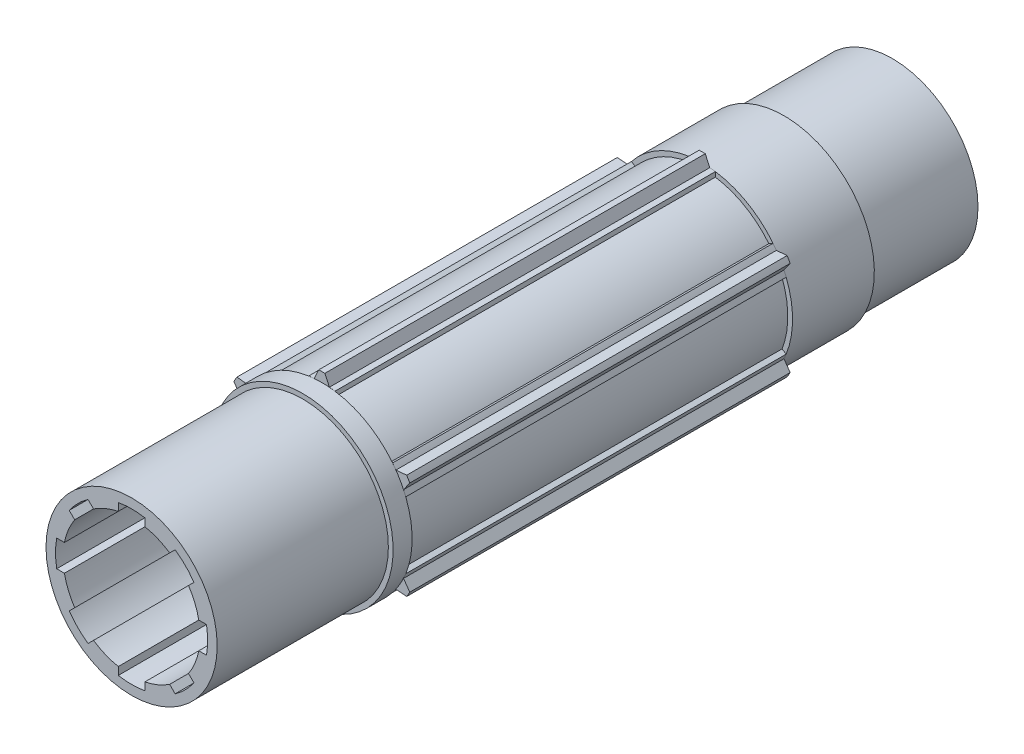
from build123d import *

# Parameters (mm, degrees)
SKETCH1_R           = 22.5
BOSS_EXTRUDE1_DEPTH = 200
BOSS_EXTRUDE2_START = 50
BOSS_EXTRUDE2_DEPTH = 100
BOSS_EXTRUDE3_START = -50
SKETCH4_R           = 23.75
SKETCH4_R_2         = 22.25
BOSS_EXTRUDE3_DEPTH = 5
BOSS_EXTRUDE4_START = -171.5
SKETCH4_2_R         = 23.75
SKETCH4_2_R_2       = 22.25
BOSS_EXTRUDE4_DEPTH = 21.5


with BuildPart() as part:
    # Sketch1 → Boss-Extrude1 (new body)
    with BuildSketch(Plane.XY):
        Circle(SKETCH1_R)
        with BuildLine():
            Line((-3.5, 19.691368668), (-3.5, 17.656443583))
            ThreePointArc((-3.5, 17.656443583), (-6.888301783, 16.629831585), (-10.010117255, 14.959864723))
            Line((-10.010117255, 14.959864723), (-11.449026581, 16.39877405))
            ThreePointArc((-11.449026581, 16.39877405), (-14.142135624, 14.142135624), (-16.39877405, 11.449026581))
            Line((-16.39877405, 11.449026581), (-14.959864723, 10.010117255))
            ThreePointArc((-14.959864723, 10.010117255), (-16.629831585, 6.888301783), (-17.656443583, 3.5))
            Line((-17.656443583, 3.5), (-19.691368668, 3.5))
            ThreePointArc((-19.691368668, 3.5), (-20, 0), (-19.691368668, -3.5))
            Line((-19.691368668, -3.5), (-17.656443583, -3.5))
            ThreePointArc((-17.656443583, -3.5), (-16.629831585, -6.888301783), (-14.959864723, -10.010117255))
            Line((-14.959864723, -10.010117255), (-16.39877405, -11.449026581))
            ThreePointArc((-16.39877405, -11.449026581), (-14.142135624, -14.142135624), (-11.449026581, -16.39877405))
            Line((-11.449026581, -16.39877405), (-10.010117255, -14.959864723))
            ThreePointArc((-10.010117255, -14.959864723), (-6.888301783, -16.629831585), (-3.5, -17.656443583))
            Line((-3.5, -17.656443583), (-3.5, -19.691368668))
            ThreePointArc((-3.5, -19.691368668), (0, -20), (3.5, -19.691368668))
            Line((3.5, -19.691368668), (3.5, -17.656443583))
            ThreePointArc((3.5, -17.656443583), (6.888301783, -16.629831585), (10.010117255, -14.959864723))
            Line((10.010117255, -14.959864723), (11.449026581, -16.39877405))
            ThreePointArc((11.449026581, -16.39877405), (14.142135624, -14.142135624), (16.39877405, -11.449026581))
            Line((16.39877405, -11.449026581), (14.959864723, -10.010117255))
            ThreePointArc((14.959864723, -10.010117255), (16.629831585, -6.888301783), (17.656443583, -3.5))
            Line((17.656443583, -3.5), (19.691368668, -3.5))
            ThreePointArc((19.691368668, -3.5), (20, 0), (19.691368668, 3.5))
            Line((19.691368668, 3.5), (17.656443583, 3.5))
            ThreePointArc((17.656443583, 3.5), (16.629831585, 6.888301783), (14.959864723, 10.010117255))
            Line((14.959864723, 10.010117255), (16.39877405, 11.449026581))
            ThreePointArc((16.39877405, 11.449026581), (14.142135624, 14.142135624), (11.449026581, 16.39877405))
            Line((11.449026581, 16.39877405), (10.010117255, 14.959864723))
            ThreePointArc((10.010117255, 14.959864723), (6.888301783, 16.629831585), (3.5, 17.656443583))
            Line((3.5, 17.656443583), (3.5, 19.691368668))
            ThreePointArc((3.5, 19.691368668), (0, 20), (-3.5, 19.691368668))
        make_face(mode=Mode.SUBTRACT)
    extrude(amount=BOSS_EXTRUDE1_DEPTH)

    # Sketch3 → Boss-Extrude2 (add)
    with BuildSketch(Plane.XY.offset(BOSS_EXTRUDE2_START)):
        with BuildLine():
            Line((-2.000027302, 23.665962711), (-0.80077241, 26.237773126))
            ThreePointArc((-0.80077241, 26.237773126), (0, 26.249990002), (0.80077241, 26.237773126))
            Line((0.80077241, 26.237773126), (2.000027302, 23.665962711))
            ThreePointArc((2.000027302, 23.665962711), (2.731879206, 23.592683956), (3.461111111, 23.496778718))
            Line((3.461111111, 23.496778718), (3.461111111, 21.979153985))
            ThreePointArc((3.461111111, 21.979153985), (0, 22.25), (-3.461111111, 21.979153985))
            Line((-3.461111111, 21.979153985), (-3.461111111, 23.496778718))
            ThreePointArc((-3.461111111, 23.496778718), (-2.731879206, 23.592683956), (-2.000027302, 23.665962711))
        make_face()
        with BuildLine():
            Line((17.303950149, 13.98698714), (18.618251721, 14.745799506))
            ThreePointArc((18.618251721, 14.745799506), (19.065924046, 14.162218771), (19.495311261, 13.565055807))
            Line((19.495311261, 13.565055807), (22.322191861, 13.812375813))
            ThreePointArc((22.322191861, 13.812375813), (22.73315819, 13.124995001), (23.122964271, 12.425397313))
            Line((23.122964271, 12.425397313), (21.495338563, 10.100906903))
            ThreePointArc((21.495338563, 10.100906903), (21.797803252, 9.430465185), (22.079362832, 8.750979211))
            Line((22.079362832, 8.750979211), (20.76506126, 7.992166845))
            ThreePointArc((20.76506126, 7.992166845), (19.269065234, 11.125), (17.303950149, 13.98698714))
        make_face()
        with BuildLine():
            Line((20.76506126, -7.992166845), (22.079362832, -8.750979211))
            ThreePointArc((22.079362832, -8.750979211), (21.797803252, -9.430465185), (21.495338563, -10.100906903))
            Line((21.495338563, -10.100906903), (23.122964271, -12.425397313))
            ThreePointArc((23.122964271, -12.425397313), (22.73315819, -13.124995001), (22.322191861, -13.812375813))
            Line((22.322191861, -13.812375813), (19.495311261, -13.565055807))
            ThreePointArc((19.495311261, -13.565055807), (19.065924046, -14.162218771), (18.618251721, -14.745799506))
            Line((18.618251721, -14.745799506), (17.303950149, -13.98698714))
            ThreePointArc((17.303950149, -13.98698714), (19.269065234, -11.125), (20.76506126, -7.992166845))
        make_face()
        with BuildLine():
            Line((3.461111111, -21.979153985), (3.461111111, -23.496778718))
            ThreePointArc((3.461111111, -23.496778718), (2.731879206, -23.592683956), (2.000027302, -23.665962711))
            Line((2.000027302, -23.665962711), (0.80077241, -26.237773126))
            ThreePointArc((0.80077241, -26.237773126), (0, -26.249990002), (-0.80077241, -26.237773126))
            Line((-0.80077241, -26.237773126), (-2.000027302, -23.665962711))
            ThreePointArc((-2.000027302, -23.665962711), (-2.731879206, -23.592683956), (-3.461111111, -23.496778718))
            Line((-3.461111111, -23.496778718), (-3.461111111, -21.979153985))
            ThreePointArc((-3.461111111, -21.979153985), (0, -22.25), (3.461111111, -21.979153985))
        make_face()
        with BuildLine():
            Line((-17.303950149, -13.98698714), (-18.618251721, -14.745799506))
            ThreePointArc((-18.618251721, -14.745799506), (-19.065924046, -14.162218771), (-19.495311261, -13.565055807))
            Line((-19.495311261, -13.565055807), (-22.322191861, -13.812375813))
            ThreePointArc((-22.322191861, -13.812375813), (-22.73315819, -13.124995001), (-23.122964271, -12.425397313))
            Line((-23.122964271, -12.425397313), (-21.495338563, -10.100906903))
            ThreePointArc((-21.495338563, -10.100906903), (-21.797803252, -9.430465185), (-22.079362832, -8.750979211))
            Line((-22.079362832, -8.750979211), (-20.76506126, -7.992166845))
            ThreePointArc((-20.76506126, -7.992166845), (-19.269065234, -11.125), (-17.303950149, -13.98698714))
        make_face()
        with BuildLine():
            Line((-20.76506126, 7.992166845), (-22.079362832, 8.750979211))
            ThreePointArc((-22.079362832, 8.750979211), (-21.797803252, 9.430465185), (-21.495338563, 10.100906903))
            Line((-21.495338563, 10.100906903), (-23.122964271, 12.425397313))
            ThreePointArc((-23.122964271, 12.425397313), (-22.73315819, 13.124995001), (-22.322191861, 13.812375813))
            Line((-22.322191861, 13.812375813), (-19.495311261, 13.565055807))
            ThreePointArc((-19.495311261, 13.565055807), (-19.065924046, 14.162218771), (-18.618251721, 14.745799506))
            Line((-18.618251721, 14.745799506), (-17.303950149, 13.98698714))
            ThreePointArc((-17.303950149, 13.98698714), (-19.269065234, 11.125), (-20.76506126, 7.992166845))
        make_face()
    extrude(amount=BOSS_EXTRUDE2_DEPTH)

    # Sketch4 → Boss-Extrude3 (add)
    with BuildSketch(Plane.XY.offset(200).offset(BOSS_EXTRUDE3_START)):
        with Locations(Location((0, 0, 0), (0, 0, 180))):
            Circle(SKETCH4_R)
        Circle(SKETCH4_R_2, mode=Mode.SUBTRACT)
    extrude(amount=BOSS_EXTRUDE3_DEPTH)

    # Sketch4<2> → Boss-Extrude4 (add)
    with BuildSketch(Plane.XY.offset(200).offset(BOSS_EXTRUDE4_START)):
        with Locations(Location((0, 0, 0), (0, 0, 180))):
            Circle(SKETCH4_2_R)
        Circle(SKETCH4_2_R_2, mode=Mode.SUBTRACT)
    extrude(amount=BOSS_EXTRUDE4_DEPTH)


solid = part.part
